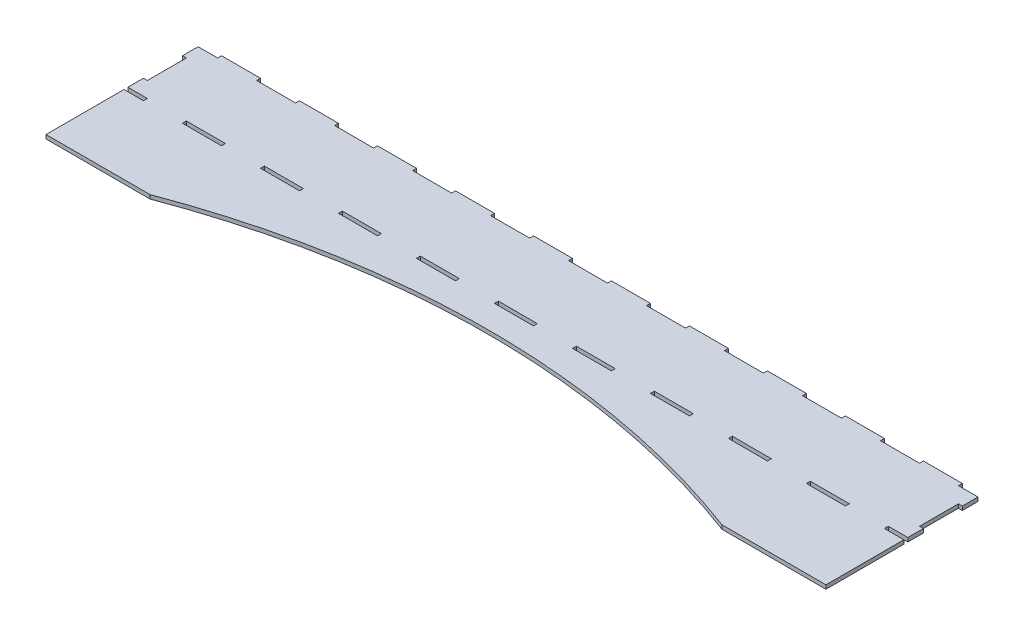
from build123d import *

# Parameters (mm, degrees)
SKETCH1_W           = 600
SKETCH1_H           = 60
BOSS_EXTRUDE1_DEPTH = 3
SKETCH3_W           = 600
SKETCH3_H           = 60
BOSS_EXTRUDE2_DEPTH = 3
SKETCH2_W           = 30
SKETCH2_H           = 3
SKETCH2_W_2         = 3
SKETCH2_H_2         = 30
CUT_EXTRUDE1_DEPTH  = 5
CUT_EXTRUDE2_DEPTH  = 5


with BuildPart() as part:
    # Sketch1 → Boss-Extrude1 (new body)
    with BuildSketch(Plane(origin=(0, 0, 0), x_dir=(1, 0, 0), z_dir=(0, 1, 0))):
        with Locations((300, 30)):
            Rectangle(SKETCH1_W, SKETCH1_H)
    extrude(amount=BOSS_EXTRUDE1_DEPTH)

    # Sketch3 → Boss-Extrude2 (add)
    with BuildSketch(Plane(origin=(0, 3, 0), x_dir=(1, 0, 0), z_dir=(0, 1, 0))):
        with Locations((300, -30)):
            Rectangle(SKETCH3_W, SKETCH3_H)
    extrude(amount=-BOSS_EXTRUDE2_DEPTH)

    # Sketch2 → Cut-Extrude1 (cut)
    with BuildSketch(Plane(origin=(0, 3, 0), x_dir=(1, 0, 0), z_dir=(0, 1, 0))):
        with Locations((0, 1.5)):
            Rectangle(SKETCH2_W, SKETCH2_H)
        with Locations((60, 1.5)):
            Rectangle(SKETCH2_W, SKETCH2_H)
        with Locations((120, 1.5)):
            Rectangle(SKETCH2_W, SKETCH2_H)
        with Locations((180, 1.5)):
            Rectangle(SKETCH2_W, SKETCH2_H)
        with Locations((240, 1.5)):
            Rectangle(SKETCH2_W, SKETCH2_H)
        with Locations((300, 1.5)):
            Rectangle(SKETCH2_W, SKETCH2_H)
        with Locations((360, 1.5)):
            Rectangle(SKETCH2_W, SKETCH2_H)
        with Locations((420, 1.5)):
            Rectangle(SKETCH2_W, SKETCH2_H)
        with Locations((480, 1.5)):
            Rectangle(SKETCH2_W, SKETCH2_H)
        with Locations((540, 1.5)):
            Rectangle(SKETCH2_W, SKETCH2_H)
        with Locations((540, 58.5)):
            Rectangle(SKETCH2_W, SKETCH2_H)
        with Locations((480, 58.5)):
            Rectangle(SKETCH2_W, SKETCH2_H)
        with Locations((420, 58.5)):
            Rectangle(SKETCH2_W, SKETCH2_H)
        with Locations((360, 58.5)):
            Rectangle(SKETCH2_W, SKETCH2_H)
        with Locations((300, 58.5)):
            Rectangle(SKETCH2_W, SKETCH2_H)
        with Locations((240, 58.5)):
            Rectangle(SKETCH2_W, SKETCH2_H)
        with Locations((180, 58.5)):
            Rectangle(SKETCH2_W, SKETCH2_H)
        with Locations((120, 58.5)):
            Rectangle(SKETCH2_W, SKETCH2_H)
        with Locations((60, 58.5)):
            Rectangle(SKETCH2_W, SKETCH2_H)
        with Locations((0, 58.5)):
            Rectangle(SKETCH2_W, SKETCH2_H)
        with Locations((1.5, 30)):
            Rectangle(SKETCH2_W_2, SKETCH2_H_2)
        with Locations((598.5, 30)):
            Rectangle(SKETCH2_W_2, SKETCH2_H_2)
        with Locations((600, 1.5)):
            Rectangle(SKETCH2_W, SKETCH2_H)
        with Locations((600, 58.5)):
            Rectangle(SKETCH2_W, SKETCH2_H)
    extrude(amount=-CUT_EXTRUDE1_DEPTH, mode=Mode.SUBTRACT)

    # Sketch4 → Cut-Extrude2 (cut)
    with BuildSketch(Plane(origin=(0, 3, 0), x_dir=(1, 0, 0), z_dir=(0, 1, 0))):
        with BuildLine():
            Line((80, -60), (520, -60))
            ThreePointArc((520, -60), (300, -20), (80, -60))
        make_face()
    extrude(amount=-CUT_EXTRUDE2_DEPTH, mode=Mode.SUBTRACT)


solid = part.part
